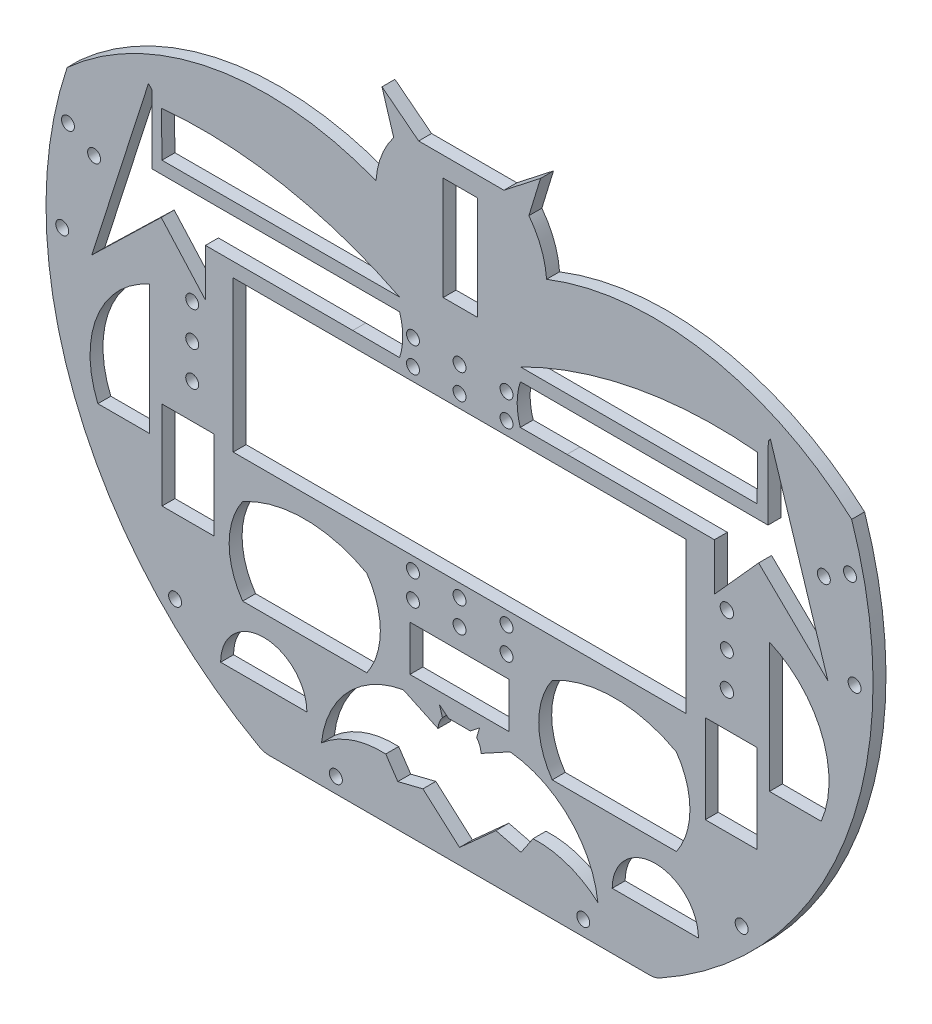
from build123d import *

# Parameters (mm, degrees)
MODEL_R                 = 1.5
MODEL_W                 = 12
MODEL_H                 = 20.5
MODEL_W_2               = 23
MODEL_H_2               = 10.5
MODEL_R_2               = 1.55
MODEL_W_3               = 105
MODEL_H_3               = 35
MODEL_W_4               = 8
MODEL_H_4               = 24
SALIENTE_EXTRUIR4_DEPTH = 3


with BuildPart() as part:
    # Model → Saliente-Extruir4 (new body)
    with BuildSketch(Plane.XY):
        with BuildLine():
            Line((-355.776015138, -60.998450132), (-267.599829389, -60.998450132))
            ThreePointArc((-267.599829389, -60.998450132), (-266.347451458, -60.839064712), (-265.17491784, -60.371069939))
            ThreePointArc((-265.17491784, -60.371069939), (-222.293639907, -11.236587904), (-220.746441381, 53.960095284))
            ThreePointArc((-220.746441381, 53.960095284), (-225.084945906, 57.549539585), (-229.703657645, 60.770445324))
            ThreePointArc((-229.703657645, 60.770445324), (-259.877190608, 71.193554512), (-291.497465301, 66.807038251))
            ThreePointArc((-291.497465301, 66.807038251), (-292.755686274, 72.473376479), (-295.600352839, 77.532860749))
            Line((-295.600352839, 77.532860749), (-295.591792135, 77.56086155))
            Line((-295.591792135, 77.56086155), (-292.895401724, 86.380357187))
            Line((-292.895401724, 86.380357187), (-301.389427163, 79.7440972))
            Line((-301.389427163, 79.7440972), (-311.281389026, 79.7440972))
            Line((-311.281389026, 79.7440972), (-321.173350888, 79.7440972))
            Line((-321.173350888, 79.7440972), (-329.667376328, 86.380357187))
            Line((-329.667376328, 86.380357187), (-326.970985917, 77.56086155))
            Line((-326.970985917, 77.56086155), (-326.962425213, 77.532860749))
            ThreePointArc((-326.962425213, 77.532860749), (-329.807091778, 72.473376479), (-331.06531275, 66.807038251))
            ThreePointArc((-331.06531275, 66.807038251), (-363.187871913, 71.263043057), (-393.802821484, 60.565396182))
            ThreePointArc((-393.802821484, 60.565396182), (-398.392570042, 57.331333816), (-402.704441803, 53.735125656))
            ThreePointArc((-402.704441803, 53.735125656), (-401.039186713, -11.347086765), (-358.200926687, -60.371069939))
            ThreePointArc((-358.200926687, -60.371069939), (-357.028393069, -60.839064712), (-355.776015138, -60.998450132))
        make_face()
        with Locations((-377.655085345, -40.498450132)):
            Circle(MODEL_R, mode=Mode.SUBTRACT)
        with Locations((-340.371601562, -57.498450132)):
            Circle(MODEL_R, mode=Mode.SUBTRACT)
        with BuildLine():
            Line((-347.094522431, -47.905049404), (-367.094522431, -47.905049404))
            ThreePointArc((-367.094522431, -47.905049404), (-357.094522431, -37.905049404), (-347.094522431, -47.905049404))
        make_face(mode=Mode.SUBTRACT)
        with Locations((-374.687922263, -13.08422583)):
            Rectangle(MODEL_W, MODEL_H, mode=Mode.SUBTRACT)
        with BuildLine():
            Line((-383.564259156, 19.787814732), (-383.564259156, -10.212185268))
            Line((-383.564259156, -10.212185268), (-395.564259156, -10.212185268))
            ThreePointArc((-395.564259156, -10.212185268), (-395.74209606, 7.258949494), (-383.564259156, 19.787814732))
        make_face(mode=Mode.SUBTRACT)
        with Locations((-373.687922263, 5.251549869)):
            Circle(MODEL_R, mode=Mode.SUBTRACT)
        with BuildLine():
            ThreePointArc((-333.187901103, -13.08422583), (-330.056215503, -23.08422583), (-333.187901103, -33.08422583))
            Line((-333.187901103, -33.08422583), (-361.987901103, -33.08422583))
            ThreePointArc((-361.987901103, -33.08422583), (-365.119586704, -23.08422583), (-361.987901103, -13.08422583))
            ThreePointArc((-361.987901103, -13.08422583), (-347.587901103, -9.377791016), (-333.187901103, -13.08422583))
        make_face(mode=Mode.SUBTRACT)
        with Locations((-322.48953205, -13.098450131)):
            Circle(MODEL_R, mode=Mode.SUBTRACT)
        with Locations((-322.48953205, -7.248450131)):
            Circle(MODEL_R, mode=Mode.SUBTRACT)
        with BuildLine():
            ThreePointArc((-307.724846888, -33.315800094), (-307.00591302, -34.594485844), (-306.687922263, -36.02654207))
            Line((-306.687922263, -36.02654207), (-299.934718732, -32.331670932))
            ThreePointArc((-299.934718732, -32.331670932), (-286.208260503, -38.793667419), (-279.594522431, -52.447660346))
            ThreePointArc((-279.594522431, -52.447660346), (-286.59107666, -48.299677368), (-294.638759456, -47.119704707))
            Line((-294.638759456, -47.119704707), (-297.434723974, -51.26489257))
            Line((-297.434723974, -51.26489257), (-303.256498331, -49.813361196))
            Line((-303.256498331, -49.813361196), (-311.687922263, -57.405049404))
            Line((-311.687922263, -57.405049404), (-320.180334417, -49.881622626))
            Line((-320.180334417, -49.881622626), (-326.002108775, -51.333154))
            Line((-326.002108775, -51.333154), (-328.798073292, -47.187966137))
            ThreePointArc((-328.798073292, -47.187966137), (-336.771965329, -48.364327922), (-343.72129462, -52.447660346))
            ThreePointArc((-343.72129462, -52.447660346), (-337.595412912, -39.178561893), (-324.720148301, -32.263147106))
            Line((-324.720148301, -32.263147106), (-316.687922263, -36.02654207))
            ThreePointArc((-316.687922263, -36.02654207), (-316.369931507, -34.594485844), (-315.650997638, -33.315800094))
            Line((-315.650997638, -33.315800094), (-316.334621158, -31.079768314))
            Line((-316.334621158, -31.079768314), (-314.187922263, -32.756953305))
            Line((-314.187922263, -32.756953305), (-309.187922263, -32.756953305))
            Line((-309.187922263, -32.756953305), (-307.041223368, -31.079768314))
            Line((-307.041223368, -31.079768314), (-307.724846888, -33.315800094))
        make_face(mode=Mode.SUBTRACT)
        with Locations((-283.004001562, -57.498450132)):
            Circle(MODEL_R, mode=Mode.SUBTRACT)
        with BuildLine():
            ThreePointArc((-276.281322096, -47.905049404), (-266.281322096, -37.905049404), (-256.281322096, -47.905049404))
            Line((-256.281322096, -47.905049404), (-276.281322096, -47.905049404))
        make_face(mode=Mode.SUBTRACT)
        with Locations((-246.258954343, -40.498450132)):
            Circle(MODEL_R, mode=Mode.SUBTRACT)
        with Locations((-311.687922263, -23.155049404)):
            Rectangle(MODEL_W_2, MODEL_H_2, mode=Mode.SUBTRACT)
        with Locations((-311.687922263, -13.098450131)):
            Circle(MODEL_R, mode=Mode.SUBTRACT)
        with Locations((-300.790542177, -13.098450131)):
            Circle(MODEL_R, mode=Mode.SUBTRACT)
        with Locations((-311.687922263, -7.248450131)):
            Circle(MODEL_R, mode=Mode.SUBTRACT)
        with Locations((-300.790542177, -7.248450131)):
            Circle(MODEL_R, mode=Mode.SUBTRACT)
        with BuildLine():
            ThreePointArc((-261.387922263, -13.08422583), (-258.256236663, -23.08422583), (-261.387922263, -33.08422583))
            Line((-261.387922263, -33.08422583), (-290.187922263, -33.08422583))
            ThreePointArc((-290.187922263, -33.08422583), (-293.319607864, -23.08422583), (-290.187922263, -13.08422583))
            ThreePointArc((-290.187922263, -13.08422583), (-275.787922263, -9.377788158), (-261.387922263, -13.08422583))
        make_face(mode=Mode.SUBTRACT)
        with Locations((-248.687922263, -13.08422583)):
            Rectangle(MODEL_W, MODEL_H, mode=Mode.SUBTRACT)
        with Locations((-249.687922263, 5.251549869)):
            Circle(MODEL_R_2, mode=Mode.SUBTRACT)
        with BuildLine():
            Line((-227.811585371, -10.212185268), (-239.811585371, -10.212185268))
            Line((-239.811585371, -10.212185268), (-239.811585371, 19.787814732))
            ThreePointArc((-239.811585371, 19.787814732), (-227.633748467, 7.258949494), (-227.811585371, -10.212185268))
        make_face(mode=Mode.SUBTRACT)
        with Locations((-403.839630577, 21.001549869)):
            Circle(MODEL_R, mode=Mode.SUBTRACT)
        with Locations((-373.687922263, 13.251549869)):
            Circle(MODEL_R, mode=Mode.SUBTRACT)
        with Locations((-373.687922263, 21.251549869)):
            Circle(MODEL_R, mode=Mode.SUBTRACT)
        with Locations((-396.445915559, 39.162490233)):
            Circle(MODEL_R, mode=Mode.SUBTRACT)
        with Locations((-402.508093385, 42.662490233)):
            Circle(MODEL_R, mode=Mode.SUBTRACT)
        with BuildLine():
            ThreePointArc((-325.594522431, 43.223476573), (-324.856684533, 38.624455287), (-325.594522431, 34.025434))
            Line((-325.594522431, 34.025434), (-336.444815564, 34.053135683))
            Line((-336.444815564, 34.053135683), (-370.619106993, 34.053135683))
            Line((-370.619106993, 34.053135683), (-370.619106993, 23.0817416))
            Line((-370.619106993, 23.0817416), (-380.871401066, 34.540754549))
            Line((-380.871401066, 34.540754549), (-396.971212692, 18.93698732))
            Line((-396.971212692, 18.93698732), (-383.824116508, 59.975759861))
            Line((-383.824116508, 59.975759861), (-383.063023773, 59.125084739))
            Line((-383.063023773, 59.125084739), (-383.036780558, 43.223476573))
            Line((-383.036780558, 43.223476573), (-325.594522431, 43.223476573))
        make_face(mode=Mode.SUBTRACT)
        with Locations((-322.48953205, 33.751530494)):
            Circle(MODEL_R, mode=Mode.SUBTRACT)
        with Locations((-322.48953205, 39.601530494)):
            Circle(MODEL_R, mode=Mode.SUBTRACT)
        with BuildLine():
            Line((-325.594522431, 46.179790486), (-380.702976272, 46.117817898))
            Line((-380.702976272, 46.117817898), (-380.811334061, 56.516231765))
            ThreePointArc((-380.811334061, 56.516231765), (-352.478131532, 55.219843079), (-325.594522431, 46.179790486))
        make_face(mode=Mode.SUBTRACT)
        with Locations((-311.687922263, 13.251549869)):
            Rectangle(MODEL_W_3, MODEL_H_3, mode=Mode.SUBTRACT)
        with Locations((-311.687922263, 33.751530494)):
            Circle(MODEL_R, mode=Mode.SUBTRACT)
        with Locations((-300.790542177, 33.751530494)):
            Circle(MODEL_R, mode=Mode.SUBTRACT)
        with Locations((-311.687922263, 39.601530494)):
            Circle(MODEL_R, mode=Mode.SUBTRACT)
        with Locations((-300.790542177, 39.601530494)):
            Circle(MODEL_R, mode=Mode.SUBTRACT)
        with Locations((-249.687922263, 13.251549869)):
            Circle(MODEL_R, mode=Mode.SUBTRACT)
        with Locations((-249.687922263, 21.251549869)):
            Circle(MODEL_R_2, mode=Mode.SUBTRACT)
        with Locations((-220.074429493, 21.001549869)):
            Circle(MODEL_R, mode=Mode.SUBTRACT)
        with BuildLine():
            Line((-297.567305128, 43.199876989), (-240.144576222, 43.103241367))
            Line((-240.144576222, 43.103241367), (-240.088099797, 60.046643019))
            Line((-240.088099797, 60.046643019), (-239.588301513, 60.668146026))
            Line((-239.588301513, 60.668146026), (-226.251035034, 18.793336547))
            Line((-226.251035034, 18.793336547), (-242.324564615, 34.424175709))
            Line((-242.324564615, 34.424175709), (-252.596128298, 22.982432354))
            Line((-252.596128298, 22.982432354), (-252.577664773, 33.953810901))
            Line((-252.577664773, 33.953810901), (-286.751907811, 34.011322086))
            Line((-286.751907811, 34.011322086), (-297.602232198, 34.00188017))
            ThreePointArc((-297.602232198, 34.00188017), (-298.323089741, 38.603682167), (-297.567305128, 43.199876989))
        make_face(mode=Mode.SUBTRACT)
        with Locations((-227.197722974, 39.275050872)):
            Circle(MODEL_R, mode=Mode.SUBTRACT)
        with Locations((-221.135545147, 42.775050872)):
            Circle(MODEL_R, mode=Mode.SUBTRACT)
        with Locations((-311.488157346, 63.138374517)):
            Rectangle(MODEL_W_4, MODEL_H_4, mode=Mode.SUBTRACT)
        with BuildLine():
            Line((-242.564510466, 56.516231765), (-242.672868255, 46.117817898))
            Line((-242.672868255, 46.117817898), (-297.567305128, 46.179790486))
            ThreePointArc((-297.567305128, 46.179790486), (-270.794233717, 55.223615887), (-242.564510466, 56.516231765))
        make_face(mode=Mode.SUBTRACT)
    extrude(amount=SALIENTE_EXTRUIR4_DEPTH)


solid = part.part
